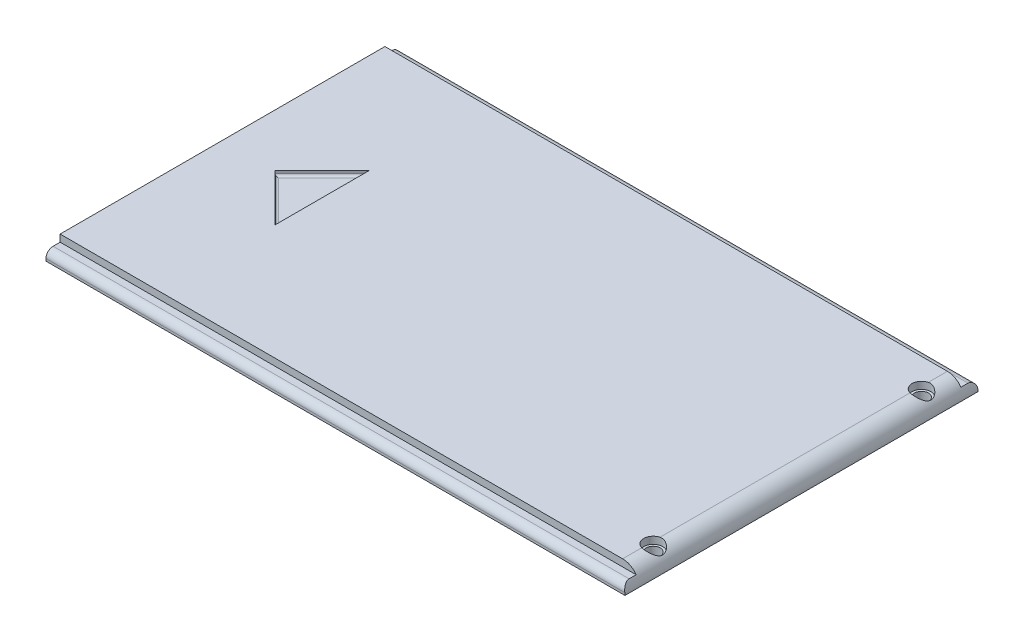
from build123d import *

# Parameters (mm, degrees)
SKETCH1_W           = 123
SKETCH1_H           = 75
BOSS_EXTRUDE1_DEPTH = 3.5
SKETCH2_W           = 123
SKETCH2_H           = 3
CUT_EXTRUDE2_DEPTH  = 1.5
FILLET1_R           = 1.5
FILLET2_R           = 1.5
FILLET3_R           = 3.49999999
CUT_EXTRUDE3_DEPTH  = 1
FILLET4_R           = 0.5
SKETCH9_R           = 2
CUT_EXTRUDE4_DEPTH  = 1.5
SKETCH10_R          = 1.5
CUT_EXTRUDE5_DEPTH  = 78.733519294


with BuildPart() as part:
    # Sketch1 → Boss-Extrude1 (new body)
    with BuildSketch(Plane(origin=(0, 0, 0), x_dir=(1, 0, 0), z_dir=(0, 1, 0))):
        with Locations((6.5, 0)):
            Rectangle(SKETCH1_W, SKETCH1_H)
    extrude(amount=-BOSS_EXTRUDE1_DEPTH)

    # Sketch2 → Cut-Extrude2 (cut)
    with BuildSketch(Plane(origin=(0, 0, 0), x_dir=(1, 0, 0), z_dir=(0, 1, 0))):
        with Locations((6.5, 36)):
            Rectangle(SKETCH2_W, SKETCH2_H)
        with Locations((6.5, -36)):
            Rectangle(SKETCH2_W, SKETCH2_H)
    extrude(amount=-CUT_EXTRUDE2_DEPTH, mode=Mode.SUBTRACT)

    # Fillet1
    fillet1_edges = [part.edges().sort_by_distance(p)[0] for p in [
        (6.5, -1.5, 37.5),
    ]]
    fillet(fillet1_edges, radius=FILLET1_R)

    # Fillet2
    fillet2_edges = [part.edges().sort_by_distance(p)[0] for p in [
        (6.5, -1.5, -37.5),
    ]]
    fillet(fillet2_edges, radius=FILLET2_R)

    # Fillet3
    fillet3_edges = [part.edges().sort_by_distance(p)[0] for p in [
        (68, 0, 0),
    ]]
    fillet(fillet3_edges, radius=FILLET3_R)

    # Sketch3 → Cut-Extrude3 (cut)
    with BuildSketch(Plane(origin=(0, 0, 0), x_dir=(1, 0, 0), z_dir=(0, 1, 0))):
        Polygon((-43.852743062, 0), (-33.852743062, -10), (-33.852743062, 10), align=None)
    extrude(amount=-CUT_EXTRUDE3_DEPTH, mode=Mode.SUBTRACT)

    # Fillet4
    fillet4_edges = [part.edges().sort_by_distance(p)[0] for p in [
        (-38.852743062, -1, -5),
        (-33.852743062, -1, 0),
        (-38.852743062, -1, 5),
    ]]
    fillet(fillet4_edges, radius=FILLET4_R)

    # Sketch9 → Cut-Extrude4 (cut)
    with BuildSketch(Plane(origin=(0, 0, 0), x_dir=(1, 0, 0), z_dir=(0, 1, 0))):
        with Locations(Location((65, -28.5, 0), (0, 0, 270))):
            Circle(SKETCH9_R)
        with Locations(Location((65, 28.5, 0), (0, 0, 270))):
            Circle(SKETCH9_R)
    extrude(amount=-CUT_EXTRUDE4_DEPTH, mode=Mode.SUBTRACT)

    # Sketch10 → Cut-Extrude5 (cut, through all)
    with BuildSketch(Plane(origin=(0, 0, 0), x_dir=(1, 0, 0), z_dir=(0, 1, 0))):
        with Locations(Location((65, 28.5, 0), (0, 0, 270))):
            Circle(SKETCH10_R)
        with Locations(Location((65, -28.5, 0), (0, 0, 270))):
            Circle(SKETCH10_R)
    extrude(amount=-CUT_EXTRUDE5_DEPTH, mode=Mode.SUBTRACT)


solid = part.part
